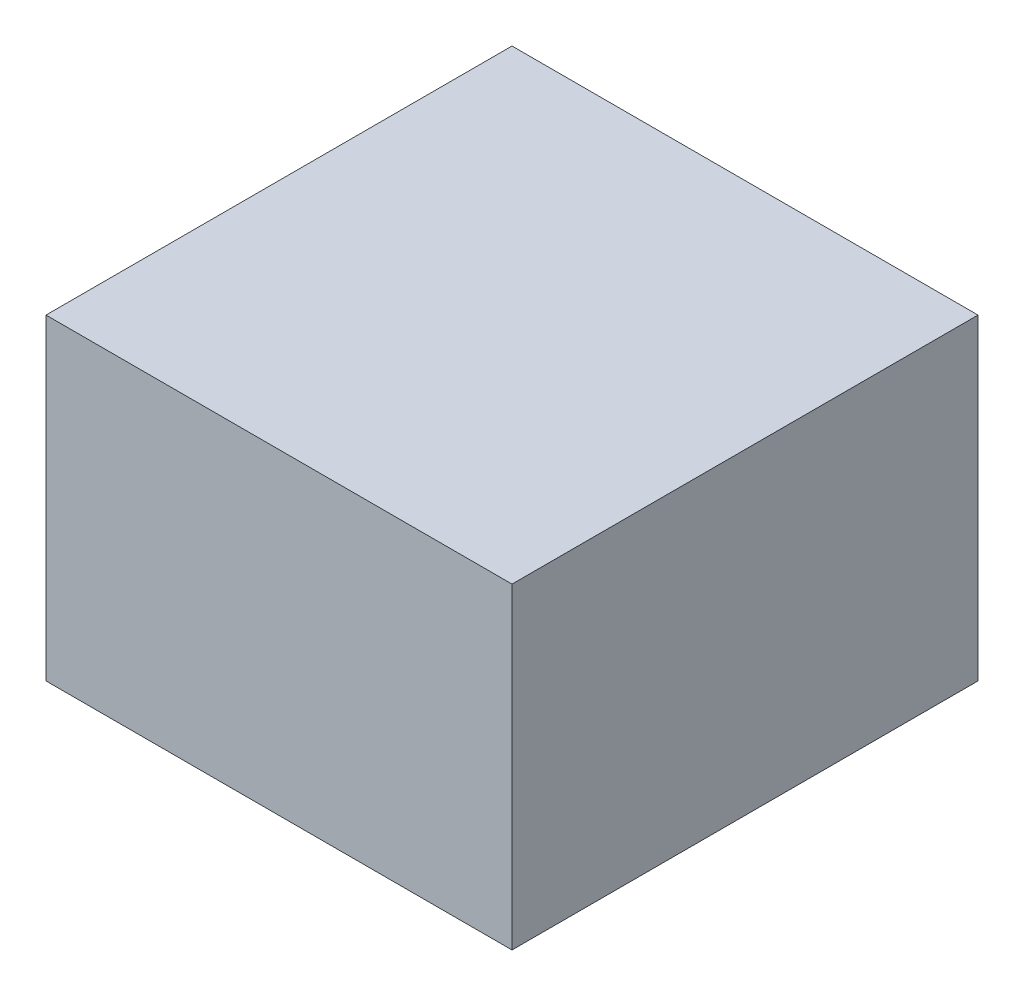
from build123d import *

# Parameters (mm, degrees)
SKETCH1_W           = 500
SKETCH1_H           = 500
BOSS_EXTRUDE1_DEPTH = 340
SKETCH2_R           = 31
CUT_EXTRUDE1_DEPTH  = 330
SKETCH3_R           = 40
CUT_EXTRUDE3_DEPTH  = 10


with BuildPart() as part:
    # Sketch1 → Boss-Extrude1 (new body)
    with BuildSketch(Plane(origin=(0, 0, 0), x_dir=(1, 0, 0), z_dir=(0, 1, 0))):
        with Locations((200, 250)):
            Rectangle(SKETCH1_W, SKETCH1_H)
    extrude(amount=BOSS_EXTRUDE1_DEPTH)

    # Sketch2 → Cut-Extrude1 (cut)
    with BuildSketch(Plane(origin=(0, 0, 0), x_dir=(-1, 0, 0), z_dir=(0, -1, 0))):
        with Locations(Location((0, 450, 0), (0, 0, 90))):
            Circle(SKETCH2_R)
        with Locations(Location((0, 350, 0), (0, 0, 90))):
            Circle(SKETCH2_R)
        with Locations(Location((0, 250, 0), (0, 0, 90))):
            Circle(SKETCH2_R)
        with Locations(Location((0, 50, 0), (0, 0, 90))):
            Circle(SKETCH2_R)
        with Locations(Location((-100, 450, 0), (0, 0, 90))):
            Circle(SKETCH2_R)
        with Locations(Location((-100, 350, 0), (0, 0, 90))):
            Circle(SKETCH2_R)
        with Locations(Location((-100, 250, 0), (0, 0, 90))):
            Circle(SKETCH2_R)
        with Locations(Location((-100, 150, 0), (0, 0, 90))):
            Circle(SKETCH2_R)
        with Locations(Location((-100, 50, 0), (0, 0, 90))):
            Circle(SKETCH2_R)
        with Locations(Location((-200, 450, 0), (0, 0, 90))):
            Circle(SKETCH2_R)
        with Locations(Location((-200, 350, 0), (0, 0, 90))):
            Circle(SKETCH2_R)
        with Locations(Location((-200, 250, 0), (0, 0, 90))):
            Circle(SKETCH2_R)
        with Locations(Location((-200, 150, 0), (0, 0, 90))):
            Circle(SKETCH2_R)
        with Locations(Location((-200, 50, 0), (0, 0, 90))):
            Circle(SKETCH2_R)
        with Locations(Location((-300, 450, 0), (0, 0, 90))):
            Circle(SKETCH2_R)
        with Locations(Location((-300, 350, 0), (0, 0, 90))):
            Circle(SKETCH2_R)
        with Locations(Location((-300, 250, 0), (0, 0, 90))):
            Circle(SKETCH2_R)
        with Locations(Location((-300, 150, 0), (0, 0, 90))):
            Circle(SKETCH2_R)
        with Locations(Location((-300, 50, 0), (0, 0, 90))):
            Circle(SKETCH2_R)
        with Locations(Location((-400, 450, 0), (0, 0, 90))):
            Circle(SKETCH2_R)
        with Locations(Location((-400, 350, 0), (0, 0, 90))):
            Circle(SKETCH2_R)
        with Locations(Location((-400, 250, 0), (0, 0, 90))):
            Circle(SKETCH2_R)
        with Locations(Location((-400, 150, 0), (0, 0, 90))):
            Circle(SKETCH2_R)
        with Locations(Location((-400, 50, 0), (0, 0, 90))):
            Circle(SKETCH2_R)
        with Locations(Location((0, 150, 0), (0, 0, 90))):
            Circle(SKETCH2_R)
    extrude(amount=-CUT_EXTRUDE1_DEPTH, mode=Mode.SUBTRACT)

    # Sketch3 → Cut-Extrude3 (cut)
    with BuildSketch(Plane(origin=(0, 0, 0), x_dir=(-1, 0, 0), z_dir=(0, -1, 0))):
        with Locations(Location((-400, 450, 0), (0, 0, 90))):
            Circle(SKETCH3_R)
        with Locations(Location((-300, 450, 0), (0, 0, 90))):
            Circle(SKETCH3_R)
        with Locations(Location((-200, 450, 0), (0, 0, 90))):
            Circle(SKETCH3_R)
        with Locations(Location((-100, 450, 0), (0, 0, 90))):
            Circle(SKETCH3_R)
        with Locations(Location((0, 450, 0), (0, 0, 90))):
            Circle(SKETCH3_R)
        with Locations(Location((-300, 350, 0), (0, 0, 90))):
            Circle(SKETCH3_R)
        with Locations(Location((-200, 350, 0), (0, 0, 90))):
            Circle(SKETCH3_R)
        with Locations(Location((-100, 350, 0), (0, 0, 90))):
            Circle(SKETCH3_R)
        with Locations(Location((0, 350, 0), (0, 0, 90))):
            Circle(SKETCH3_R)
        with Locations(Location((-300, 250, 0), (0, 0, 90))):
            Circle(SKETCH3_R)
        with Locations(Location((-200, 250, 0), (0, 0, 90))):
            Circle(SKETCH3_R)
        with Locations(Location((-100, 250, 0), (0, 0, 90))):
            Circle(SKETCH3_R)
        with Locations(Location((0, 250, 0), (0, 0, 90))):
            Circle(SKETCH3_R)
        with Locations(Location((-300, 150, 0), (0, 0, 90))):
            Circle(SKETCH3_R)
        with Locations(Location((-200, 150, 0), (0, 0, 90))):
            Circle(SKETCH3_R)
        with Locations(Location((-100, 150, 0), (0, 0, 90))):
            Circle(SKETCH3_R)
        with Locations(Location((0, 150, 0), (0, 0, 90))):
            Circle(SKETCH3_R)
        with Locations(Location((-300, 50, 0), (0, 0, 90))):
            Circle(SKETCH3_R)
        with Locations(Location((-200, 50, 0), (0, 0, 90))):
            Circle(SKETCH3_R)
        with Locations(Location((-100, 50, 0), (0, 0, 90))):
            Circle(SKETCH3_R)
        with Locations(Location((0, 50, 0), (0, 0, 90))):
            Circle(SKETCH3_R)
        with Locations(Location((-400, 350, 0), (0, 0, 90))):
            Circle(SKETCH3_R)
        with Locations(Location((-400, 250, 0), (0, 0, 90))):
            Circle(SKETCH3_R)
        with Locations(Location((-400, 150, 0), (0, 0, 90))):
            Circle(SKETCH3_R)
        with Locations(Location((-400, 50, 0), (0, 0, 90))):
            Circle(SKETCH3_R)
    extrude(amount=-CUT_EXTRUDE3_DEPTH, mode=Mode.SUBTRACT)


solid = part.part
